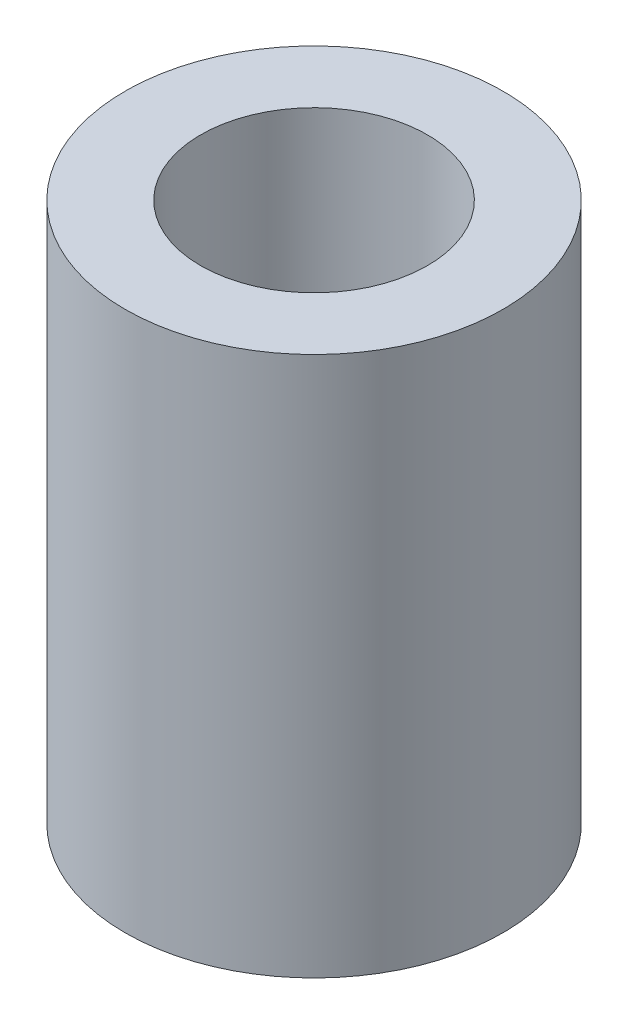
from build123d import *

# Parameters (mm, degrees)
SKETCH1_R           = 3.5
SKETCH1_R_2         = 2.1
BOSS_EXTRUDE1_DEPTH = 10


with BuildPart() as part:
    # Sketch1 → Boss-Extrude1 (new body)
    with BuildSketch(Plane(origin=(0, 0, 0), x_dir=(1, 0, 0), z_dir=(0, 1, 0))):
        with Locations(Location((0, 0, 0), (0, 0, 270))):
            Circle(SKETCH1_R)
        with Locations(Location((0, 0, 0), (0, 0, 270))):
            Circle(SKETCH1_R_2, mode=Mode.SUBTRACT)
    extrude(amount=BOSS_EXTRUDE1_DEPTH)


solid = part.part
